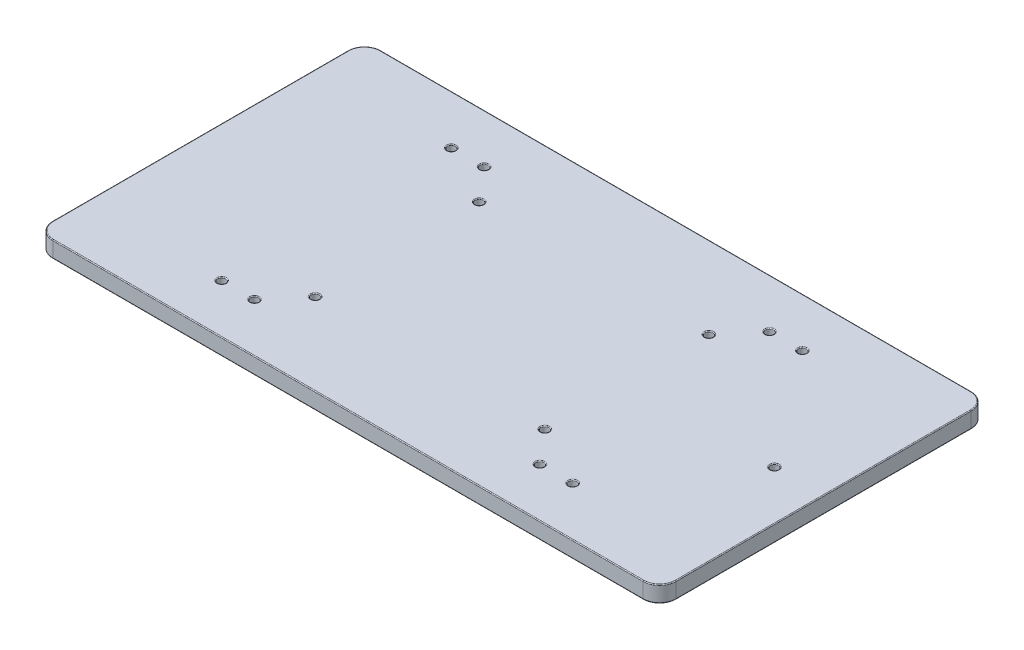
from build123d import *

# Parameters (mm, degrees)
SKETCH1_W           = 190
SKETCH1_H           = 100
SKETCH1_R           = 1.25
BOSS_EXTRUDE1_DEPTH = 5
FILLET1_R           = 5
FILLET2_R           = 0.25


with BuildPart() as part:
    # Sketch1 → Boss-Extrude1 (new body)
    with BuildSketch(Plane(origin=(0, 0, 0), x_dir=(1, 0, 0), z_dir=(0, 1, 0))):
        Rectangle(SKETCH1_W, SKETCH1_H)
        with Locations(Location((-35, 25, 0), (0, 0, 270))):
            Circle(SKETCH1_R, mode=Mode.SUBTRACT)
        with Locations(Location((35, 25, 0), (0, 0, 270))):
            Circle(SKETCH1_R, mode=Mode.SUBTRACT)
        with Locations(Location((35, -25, 0), (0, 0, 270))):
            Circle(SKETCH1_R, mode=Mode.SUBTRACT)
        with Locations(Location((-35, -25, 0), (0, 0, 270))):
            Circle(SKETCH1_R, mode=Mode.SUBTRACT)
        with Locations(Location((80, 0, 0), (0, 0, 270))):
            Circle(SKETCH1_R, mode=Mode.SUBTRACT)
        with Locations(Location((-53.5, -35, 0), (0, 0, 270))):
            Circle(SKETCH1_R, mode=Mode.SUBTRACT)
        with Locations(Location((-43.5, -35, 0), (0, 0, 270))):
            Circle(SKETCH1_R, mode=Mode.SUBTRACT)
        with Locations(Location((43.5, -35, 0), (0, 0, 270))):
            Circle(SKETCH1_R, mode=Mode.SUBTRACT)
        with Locations(Location((53.5, -35, 0), (0, 0, 270))):
            Circle(SKETCH1_R, mode=Mode.SUBTRACT)
        with Locations(Location((53.5, 35, 0), (0, 0, 270))):
            Circle(SKETCH1_R, mode=Mode.SUBTRACT)
        with Locations(Location((43.5, 35, 0), (0, 0, 270))):
            Circle(SKETCH1_R, mode=Mode.SUBTRACT)
        with Locations(Location((-43.5, 35, 0), (0, 0, 270))):
            Circle(SKETCH1_R, mode=Mode.SUBTRACT)
        with Locations(Location((-53.5, 35, 0), (0, 0, 270))):
            Circle(SKETCH1_R, mode=Mode.SUBTRACT)
    extrude(amount=BOSS_EXTRUDE1_DEPTH)

    # Fillet1
    fillet1_edges = [part.edges().sort_by_distance(p)[0] for p in [
        (95, 2.5, 50),
        (-95, 2.5, 50),
        (-95, 2.5, -50),
        (95, 2.5, -50),
    ]]
    fillet(fillet1_edges, radius=FILLET1_R)

    # Fillet2
    fillet2_edges = [part.edges().sort_by_distance(p)[0] for p in [
        (-53.5, 5, -36.25),
        (-35, 5, 23.75),
        (-53.5, 0, -36.25),
        (53.5, 0, 33.75),
        (35, 5, -26.25),
        (-35, 0, -26.25),
        (80, 0, -1.25),
        (-53.5, 0, 33.75),
        (-43.5, 0, 33.75),
        (43.5, 0, 33.75),
        (53.5, 0, -36.25),
        (43.5, 0, -36.25),
        (-43.5, 0, -36.25),
        (35, 0, 23.75),
        (35, 0, -26.25),
        (-35, 0, 23.75),
        (35, 5, 23.75),
        (-43.5, 5, -36.25),
        (43.5, 5, -36.25),
        (53.5, 5, -36.25),
        (43.5, 5, 33.75),
        (0, 0, 50),
        (0, 5, 50),
        (95, 0, 0),
        (-95, 0, 0),
        (-43.5, 5, 33.75),
        (0, 0, -50),
        (-93.535533906, 0, -48.535533906),
        (93.535533906, 0, -48.535533906),
        (93.535533906, 0, 48.535533906),
        (-93.535533906, 0, 48.535533906),
        (-95, 5, 0),
        (95, 5, 0),
        (-53.5, 5, 33.75),
        (0, 5, -50),
        (-93.535533906, 5, -48.535533906),
        (93.535533906, 5, -48.535533906),
        (93.535533906, 5, 48.535533906),
        (-93.535533906, 5, 48.535533906),
        (80, 5, -1.25),
        (-35, 5, -26.25),
        (53.5, 5, 33.75),
    ]]
    fillet(fillet2_edges, radius=FILLET2_R)


solid = part.part
